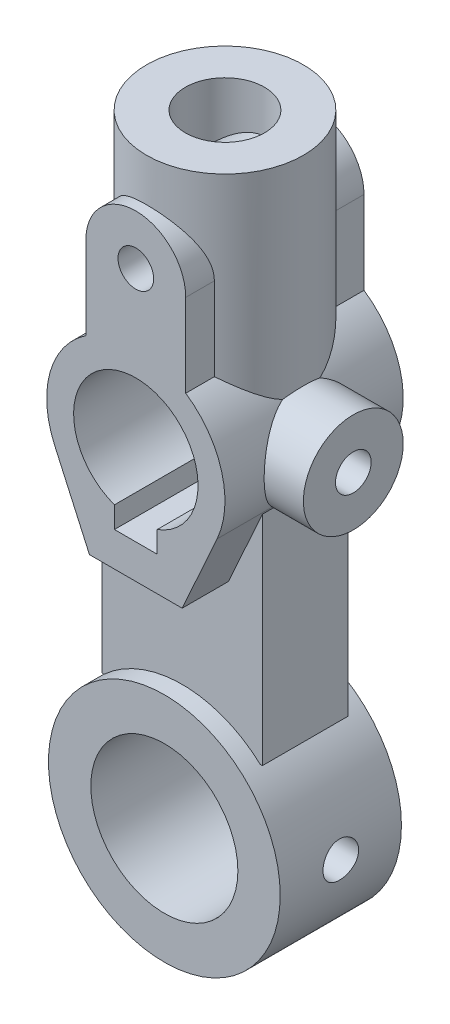
from build123d import *

# Parameters (mm, degrees)
SKETCH1_R           = 32.5
SKETCH1_R_2         = 20.625
BOSS_EXTRUDE1_DEPTH = 17
BOSS_EXTRUDE2_START = 24
SKETCH2_W           = 45
SKETCH2_H           = 24
BOSS_EXTRUDE2_DEPTH = 72
SKETCH4_R           = 5
CUT_EXTRUDE1_DEPTH  = 103.767942472
SKETCH7_R           = 5
BOSS_EXTRUDE3_DEPTH = 25
BOSS_EXTRUDE4_REACH = 204.691
SKETCH8_R           = 22
SKETCH8_R_2         = 11.1
BOSS_EXTRUDE5_REACH = 183.31
SKETCH10_R          = 14
SKETCH10_R_2        = 5
SKETCH14_R          = 5
CUT_EXTRUDE3_DEPTH  = 34
CUT_EXTRUDE4_REACH  = 175.842


with BuildPart() as part:
    # Sketch1 → Boss-Extrude1 (new, symmetric)
    with BuildSketch(Plane.XY):
        Circle(SKETCH1_R)
        Circle(SKETCH1_R_2, mode=Mode.SUBTRACT)
    extrude(amount=BOSS_EXTRUDE1_DEPTH, both=True)

    # Sketch2 → Boss-Extrude2 (add)
    with BuildSketch(Plane(origin=(0, 0, 0), x_dir=(1, 0, 0), z_dir=(0, 1, 0)).offset(BOSS_EXTRUDE2_START)):
        Rectangle(SKETCH2_W, SKETCH2_H)
    extrude(amount=BOSS_EXTRUDE2_DEPTH)

    # Sketch4 → Cut-Extrude1 (cut, through all)
    with BuildSketch(Plane(origin=(0, 0, 0), x_dir=(0, 0, -1), z_dir=(1, 0, 0))):
        with Locations(Location((0, 0, 0), (0, 0, 180))):
            Circle(SKETCH4_R)
    extrude(amount=CUT_EXTRUDE1_DEPTH, mode=Mode.SUBTRACT)

    # Sketch7 → Boss-Extrude3 (add, symmetric)
    with BuildSketch(Plane.XY):
        with BuildLine():
            Line((-13, 64), (13, 64))
            Line((13, 64), (22.792288735, 85.728117298))
            ThreePointArc((22.792288735, 85.728117298), (24.050431537, 102.824715589), (14, 116.712315177))
            Line((14, 116.712315177), (14, 140))
            ThreePointArc((14, 140), (0, 154), (-14, 140))
            Line((-14, 140), (-14, 116.712315177))
            ThreePointArc((-14, 116.712315177), (-24.050431537, 102.824715589), (-22.792288735, 85.728117298))
            Line((-22.792288735, 85.728117298), (-13, 64))
        make_face()
        with Locations((0, 140)):
            Circle(SKETCH7_R, mode=Mode.SUBTRACT)
        with BuildLine():
            Line((-6, 73.61), (6, 73.61))
            Line((6, 73.61), (6, 79.613954107))
            ThreePointArc((6, 79.613954107), (0, 113.45), (-6, 79.613954107))
            Line((-6, 79.613954107), (-6, 73.61))
        make_face(mode=Mode.SUBTRACT)
    extrude(amount=BOSS_EXTRUDE3_DEPTH, both=True)

    # Sketch8 → Boss-Extrude4 (add, up to next)
    with BuildSketch(Plane(origin=(0, 166, 0), x_dir=(1, 0, 0), z_dir=(0, 1, 0)), mode=Mode.PRIVATE) as boss_extrude4_sk1:
        with Locations(Location((0, 0, 0), (0, 0, 270))):
            Circle(SKETCH8_R)
        with Locations(Location((0, 0, 0), (0, 0, 270))):
            Circle(SKETCH8_R_2, mode=Mode.SUBTRACT)
    boss_extrude4_tool1 = extrude(boss_extrude4_sk1.sketch, amount=-BOSS_EXTRUDE4_REACH, mode=Mode.PRIVATE) - part.part
    add(boss_extrude4_tool1.solids().sort_by_distance((0, 166, -21.377746))[0])

    # Sketch10 → Boss-Extrude5 (add, up to next)
    with BuildSketch(Plane(origin=(36, 0, 0), x_dir=(0, 0, -1), z_dir=(1, 0, 0)), mode=Mode.PRIVATE) as boss_extrude5_sk1:
        with Locations((0, 96)):
            Circle(SKETCH10_R)
        with Locations((0, 96)):
            Circle(SKETCH10_R_2, mode=Mode.SUBTRACT)
    boss_extrude5_tool1 = extrude(boss_extrude5_sk1.sketch, amount=-BOSS_EXTRUDE5_REACH, mode=Mode.PRIVATE) - part.part
    add(boss_extrude5_tool1.solids().sort_by_distance((36, 96, 13.60402))[0])

    # Sketch14 → Cut-Extrude3 (cut)
    with BuildSketch(Plane(origin=(36, 0, 0), x_dir=(0, 0, -1), z_dir=(1, 0, 0))):
        with Locations((0, 96)):
            Circle(SKETCH14_R)
    extrude(amount=-CUT_EXTRUDE3_DEPTH, mode=Mode.SUBTRACT)

    # Sketch15 → Cut-Extrude4 (cut, up to next)
    with BuildSketch(Plane.XY.offset(12), mode=Mode.PRIVATE) as cut_extrude4_sk1:
        with BuildLine():
            Line((6, 73.61), (6, 79.613954107))
            ThreePointArc((6, 79.613954107), (14.303889331, 86.00493872), (17.45, 96))
            Line((17.45, 96), (-17.45, 96))
            ThreePointArc((-17.45, 96), (-14.303889331, 86.00493872), (-6, 79.613954107))
            Line((-6, 79.613954107), (-6, 73.61))
            Line((-6, 73.61), (6, 73.61))
        make_face()
    cut_extrude4_tool1 = extrude(cut_extrude4_sk1.sketch, amount=-CUT_EXTRUDE4_REACH, mode=Mode.PRIVATE) & part.part
    add(cut_extrude4_tool1.solids().sort_by_distance((0, 87.149335, 12))[0], mode=Mode.SUBTRACT)


solid = part.part
